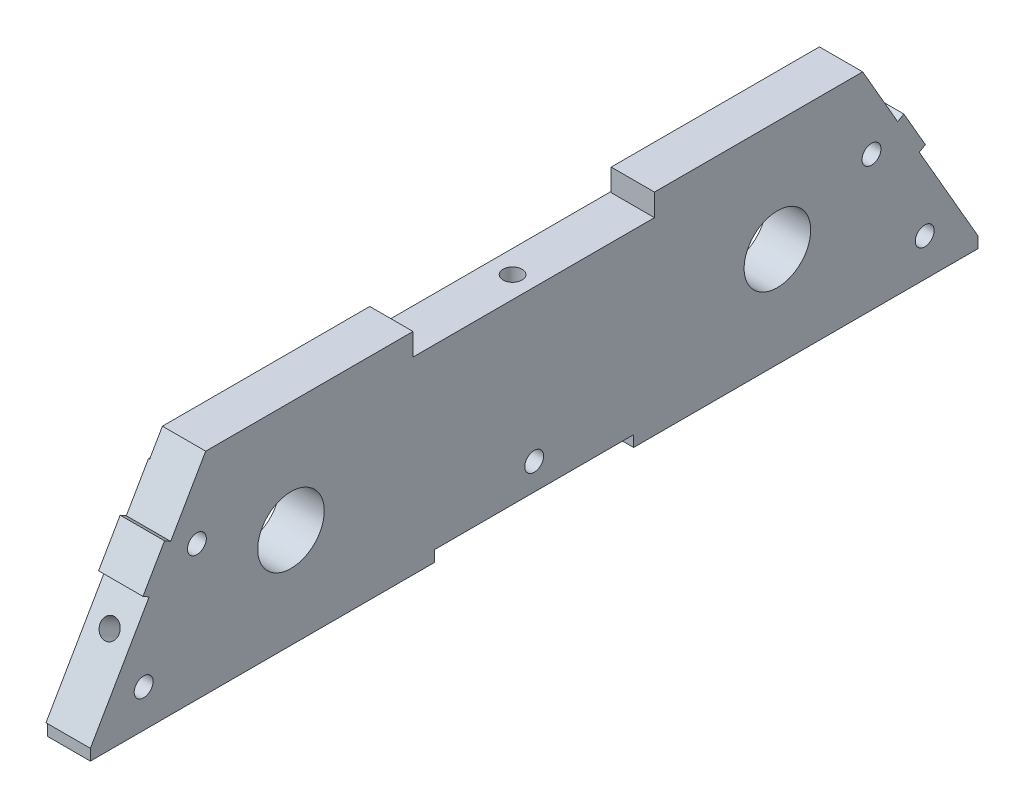
from build123d import *

# Parameters (mm, degrees)
SKETCH1_R                     = 4.7625
BOSS_EXTRUDE1_DEPTH           = 6.35
SKETCH7_W                     = 6.35
SKETCH7_H                     = 6.1722
BOSS_EXTRUDE2_DEPTH           = 1.016
SKETCH8_W                     = 6.35
SKETCH8_H                     = 6.1722
BOSS_EXTRUDE3_DEPTH           = 1.016
TAP_DRILL_FOR_6_32_TAP1_D     = 2.7051
TAP_DRILL_FOR_6_32_TAP1_DEPTH = 6.35
TAP_DRILL_FOR_6_32_TAP1_TIP   = 0.81269403
TAP_DRILL_FOR_6_32_TAP2_D     = 2.7051
TAP_DRILL_FOR_6_32_TAP2_DEPTH = 6.35
TAP_DRILL_FOR_6_32_TAP2_TIP   = 0.81269403
TAP_DRILL_FOR_6_32_TAP3_D     = 2.7051
TAP_DRILL_FOR_6_32_TAP3_DEPTH = 6.35
TAP_DRILL_FOR_6_32_TAP3_TIP   = 0.81269403
SKETCH18_W                    = 53.721
SKETCH18_H                    = 12.7
CUT_EXTRUDE1_DEPTH            = 3.175
FILLET1_R                     = 2.54
SKETCH19_W                    = 6.19125
SKETCH19_H                    = 31.625875518
SKETCH19_H_2                  = 31.500730808
BOSS_EXTRUDE4_DEPTH           = 3.175
CUT_EXTRUDE2_DEPTH            = 131.329786024
TAP_DRILL_FOR_6_32_TAP4_D     = 2.7051
TAP_DRILL_FOR_6_32_TAP4_DEPTH = 10.16
TAP_DRILL_FOR_6_32_TAP4_TIP   = 0.81269403
SKETCH23_W                    = 6.12775
SKETCH23_H                    = 49.2125
SKETCH23_H_2                  = 49.276
BOSS_EXTRUDE5_DEPTH           = 1.5875


with BuildPart() as part:
    # Sketch1 → Boss-Extrude1 (new body)
    with BuildSketch(Plane(origin=(0, 0, 0), x_dir=(0, 0, -1), z_dir=(1, 0, 0))):
        Polygon((0, 0), (-14.664696837, 25.4), (-112.335303163, 25.4), (-127, 0), align=None)
        with Locations((-98.298, 12.7)):
            Circle(SKETCH1_R, mode=Mode.SUBTRACT)
        with Locations((-28.702, 12.7)):
            Circle(SKETCH1_R, mode=Mode.SUBTRACT)
    extrude(amount=BOSS_EXTRUDE1_DEPTH)

    # Sketch7 → Boss-Extrude2 (add)
    with BuildSketch(Plane(origin=(0, 0, 0), x_dir=(-1, 0, 0), z_dir=(0, 0.499999999999998, -0.8660254037844397))):
        with Locations((-3.175, 19.893293675)):
            Rectangle(SKETCH7_W, SKETCH7_H)
    extrude(amount=BOSS_EXTRUDE2_DEPTH)

    # Sketch8 → Boss-Extrude3 (add)
    with BuildSketch(Plane(origin=(0, 54.99261314, 95.25), x_dir=(1, 0, 0), z_dir=(0, 0.500000000000004, 0.8660254037844365))):
        with Locations((3.175, -43.606706325)):
            Rectangle(SKETCH8_W, SKETCH8_H)
    extrude(amount=BOSS_EXTRUDE3_DEPTH)

    # Tap Drill for #6-32 Tap1
    with Locations(Plane(origin=(6.35, 0, 0), x_dir=(0, 0, -1), z_dir=(1, 0, 0))):
        with Locations((-111.761034973, 17.736097687), (-15.238965027, 17.736097687), (-119.38, 3.81), (-7.62, 3.81), (-63.5, 3.81)):
            Hole(TAP_DRILL_FOR_6_32_TAP1_D / 2, depth=TAP_DRILL_FOR_6_32_TAP1_DEPTH)
            with Locations((0, 0, -(TAP_DRILL_FOR_6_32_TAP1_DEPTH + TAP_DRILL_FOR_6_32_TAP1_TIP / 2))):  # 118° drill point
                Cone(0, TAP_DRILL_FOR_6_32_TAP1_D / 2, TAP_DRILL_FOR_6_32_TAP1_TIP, mode=Mode.SUBTRACT)

    # Tap Drill for #6-32 Tap2
    with Locations(Plane(origin=(0, 54.99261314, 95.25), x_dir=(1, 0, 0), z_dir=(0, 0.500000000000004, 0.8660254037844365))):
        with Locations((3.175, -51.633106325)):
            Hole(TAP_DRILL_FOR_6_32_TAP2_D / 2, depth=TAP_DRILL_FOR_6_32_TAP2_DEPTH)
            with Locations((0, 0, -(TAP_DRILL_FOR_6_32_TAP2_DEPTH + TAP_DRILL_FOR_6_32_TAP2_TIP / 2))):  # 118° drill point
                Cone(0, TAP_DRILL_FOR_6_32_TAP2_D / 2, TAP_DRILL_FOR_6_32_TAP2_TIP, mode=Mode.SUBTRACT)

    # Tap Drill for #6-32 Tap3
    with Locations(Plane(origin=(0, 0, 0), x_dir=(-1, 0, 0), z_dir=(0, 0.49999999999999806, -0.8660254037844398))):
        with Locations((-3.175, 11.866893675)):
            Hole(TAP_DRILL_FOR_6_32_TAP3_D / 2, depth=TAP_DRILL_FOR_6_32_TAP3_DEPTH)
            with Locations((0, 0, -(TAP_DRILL_FOR_6_32_TAP3_DEPTH + TAP_DRILL_FOR_6_32_TAP3_TIP / 2))):  # 118° drill point
                Cone(0, TAP_DRILL_FOR_6_32_TAP3_D / 2, TAP_DRILL_FOR_6_32_TAP3_TIP, mode=Mode.SUBTRACT)

    # Sketch18 → Cut-Extrude1 (cut)
    with BuildSketch(Plane.ZY):
        with Locations((63.5, 14.2875)):
            Rectangle(SKETCH18_W, SKETCH18_H)
    extrude(amount=-CUT_EXTRUDE1_DEPTH, mode=Mode.SUBTRACT)

    # Fillet1
    fillet1_edges = [part.edges().sort_by_distance(p)[0] for p in [
        (1.5875, 7.9375, 36.6395),
        (1.5875, 20.6375, 36.6395),
        (1.5875, 20.6375, 90.3605),
        (1.5875, 7.9375, 90.3605),
    ]]
    fillet(fillet1_edges, radius=FILLET1_R)

    # Sketch19 → Boss-Extrude4 (add)
    with BuildSketch(Plane(origin=(0, 25.4, 0), x_dir=(1, 0, 0), z_dir=(0, 1, 0))):
        with Locations((3.254375, -30.477634596)):
            Rectangle(SKETCH19_W, SKETCH19_H)
        with Locations((3.254375, -96.584937759)):
            Rectangle(SKETCH19_W, SKETCH19_H_2)
    extrude(amount=BOSS_EXTRUDE4_DEPTH)

    # Sketch20 → Cut-Extrude2 (cut, through all)
    with BuildSketch(Plane(origin=(6.35, 0, 0), x_dir=(0, 0, -1), z_dir=(1, 0, 0))):
        Polygon((-112.335303163, 25.4), (-110.502216058, 28.575), (-112.335303163, 28.575), align=None)
        Polygon((-14.664696837, 25.4), (-16.497783942, 28.575), (-14.664696837, 28.575), align=None)
    extrude(amount=-CUT_EXTRUDE2_DEPTH, mode=Mode.SUBTRACT)

    # Tap Drill for #6-32 Tap4
    with Locations(Plane(origin=(0, 25.4, 0), x_dir=(1, 0, 0), z_dir=(0, 1, 0))):
        with Locations((3.254375, -63.5)):
            Hole(TAP_DRILL_FOR_6_32_TAP4_D / 2, depth=TAP_DRILL_FOR_6_32_TAP4_DEPTH)
            with Locations((0, 0, -(TAP_DRILL_FOR_6_32_TAP4_DEPTH + TAP_DRILL_FOR_6_32_TAP4_TIP / 2))):  # 118° drill point
                Cone(0, TAP_DRILL_FOR_6_32_TAP4_D / 2, TAP_DRILL_FOR_6_32_TAP4_TIP, mode=Mode.SUBTRACT)

    # Sketch23 → Boss-Extrude5 (add)
    with BuildSketch(Plane.XZ):
        with Locations((3.286125, 102.39375)):
            Rectangle(SKETCH23_W, SKETCH23_H)
        with Locations((3.286125, 24.638)):
            Rectangle(SKETCH23_W, SKETCH23_H_2)
    extrude(amount=BOSS_EXTRUDE5_DEPTH)


solid = part.part
